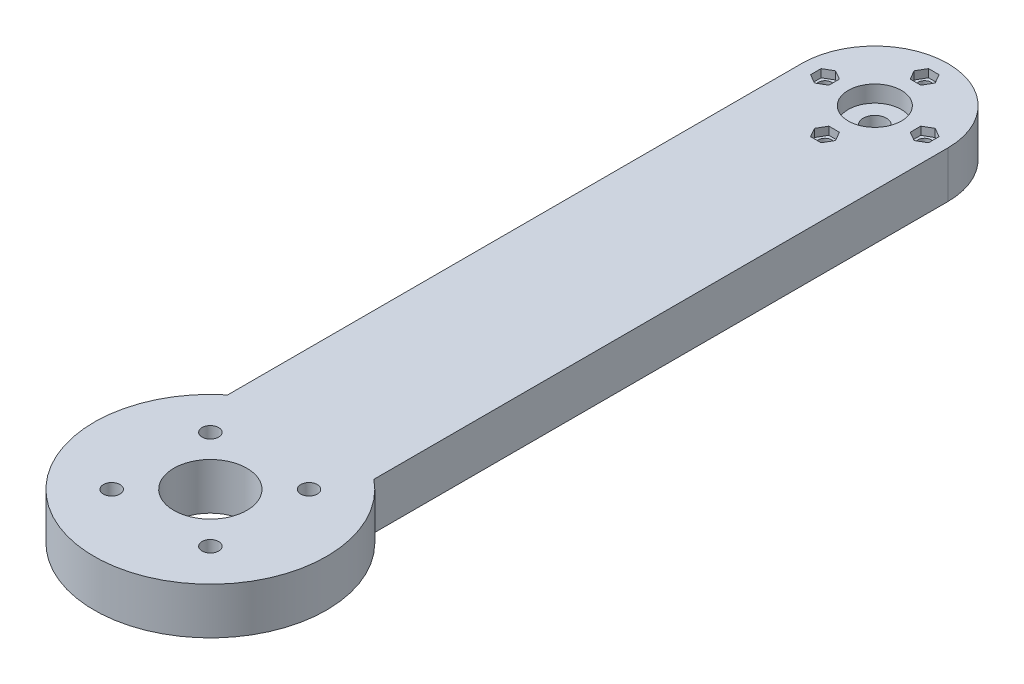
from build123d import *

# Parameters (mm, degrees)
BOSS_EXTRUDE1_DEPTH = 14
SKETCH2_R           = 8
CUT_EXTRUDE1_DEPTH  = 5
SKETCH3_R           = 3.5
CUT_EXTRUDE2_DEPTH  = 224.526284808
CUT_EXTRUDE9_DEPTH  = 2.4
SKETCH7_R           = 2
CUT_EXTRUDE10_DEPTH = 224.526284808
SKETCH8_R           = 35
BOSS_EXTRUDE2_DEPTH = 14
SKETCH9_R           = 2.5
SKETCH9_R_2         = 11
CUT_EXTRUDE11_DEPTH = 239.004201644


with BuildPart() as part:
    # Sketch1 → Boss-Extrude1 (new body)
    with BuildSketch(Plane(origin=(0, 0, 0), x_dir=(1, 0, 0), z_dir=(0, 1, 0))):
        with BuildLine():
            Line((-22, 0), (-22, -200))
            ThreePointArc((-22, -200), (0, -222), (22, -200))
            Line((22, -200), (22, 0))
            ThreePointArc((22, 0), (0, 22), (-22, 0))
        make_face()
    extrude(amount=BOSS_EXTRUDE1_DEPTH)

    # Sketch2 → Cut-Extrude1 (cut)
    with BuildSketch(Plane(origin=(0, 14, 0), x_dir=(1, 0, 0), z_dir=(0, 1, 0))):
        with Locations(Location((0, 0, 0), (0, 0, 270))):
            Circle(SKETCH2_R)
    extrude(amount=-CUT_EXTRUDE1_DEPTH, mode=Mode.SUBTRACT)

    # Sketch3 → Cut-Extrude2 (cut, through all)
    with BuildSketch(Plane(origin=(0, 14, 0), x_dir=(1, 0, 0), z_dir=(0, 1, 0))):
        with Locations(Location((0, 0, 0), (0, 0, 270))):
            Circle(SKETCH3_R)
    extrude(amount=-CUT_EXTRUDE2_DEPTH, mode=Mode.SUBTRACT)

    # Sketch4 → Cut-Extrude9 (cut)
    with BuildSketch(Plane(origin=(0, 14, 0), x_dir=(1, 0, 0), z_dir=(0, 1, 0))):
        Polygon((15, -3.175426481), (17.75, -1.58771324), (17.75, 1.58771324), (15, 3.175426481), (12.25, 1.58771324), (12.25, -1.58771324), align=None)
        Polygon((3.175426481, 15), (1.58771324, 17.75), (-1.58771324, 17.75), (-3.175426481, 15), (-1.58771324, 12.25), (1.58771324, 12.25), align=None)
        Polygon((-3.175426481, -15), (-1.58771324, -17.75), (1.58771324, -17.75), (3.175426481, -15), (1.58771324, -12.25), (-1.58771324, -12.25), align=None)
        Polygon((-15, 3.175426481), (-17.75, 1.58771324), (-17.75, -1.58771324), (-15, -3.175426481), (-12.25, -1.58771324), (-12.25, 1.58771324), align=None)
    extrude(amount=-CUT_EXTRUDE9_DEPTH, mode=Mode.SUBTRACT)

    # Sketch7 → Cut-Extrude10 (cut, through all)
    with BuildSketch(Plane(origin=(0, 14, 0), x_dir=(1, 0, 0), z_dir=(0, 1, 0))):
        with Locations(Location((0, 15, 0), (0, 0, 270))):
            Circle(SKETCH7_R)
        with Locations(Location((15, 0, 0), (0, 0, 270))):
            Circle(SKETCH7_R)
        with Locations(Location((0, -15, 0), (0, 0, 270))):
            Circle(SKETCH7_R)
        with Locations(Location((-15, 0, 0), (0, 0, 270))):
            Circle(SKETCH7_R)
    extrude(amount=-CUT_EXTRUDE10_DEPTH, mode=Mode.SUBTRACT)

    # Sketch8 → Boss-Extrude2 (add)
    with BuildSketch(Plane(origin=(0, 0, 0), x_dir=(1, 0, 0), z_dir=(0, 1, 0))):
        with Locations((0, -200)):
            Circle(SKETCH8_R)
    extrude(amount=BOSS_EXTRUDE2_DEPTH)

    # Sketch9 → Cut-Extrude11 (cut, through all)
    with BuildSketch(Plane(origin=(0, 14, 0), x_dir=(1, 0, 0), z_dir=(0, 1, 0))):
        with Locations(Location((-14.849242405, -185.150757595, 0), (0, 0, 270))):
            Circle(SKETCH9_R)
        with Locations(Location((14.849242405, -185.150757595, 0), (0, 0, 270))):
            Circle(SKETCH9_R)
        with Locations(Location((14.849242405, -214.849242405, 0), (0, 0, 270))):
            Circle(SKETCH9_R)
        with Locations(Location((-14.849242405, -214.849242405, 0), (0, 0, 270))):
            Circle(SKETCH9_R)
        with Locations(Location((0, -200, 0), (0, 0, 270))):
            Circle(SKETCH9_R_2)
    extrude(amount=-CUT_EXTRUDE11_DEPTH, mode=Mode.SUBTRACT)


solid = part.part
